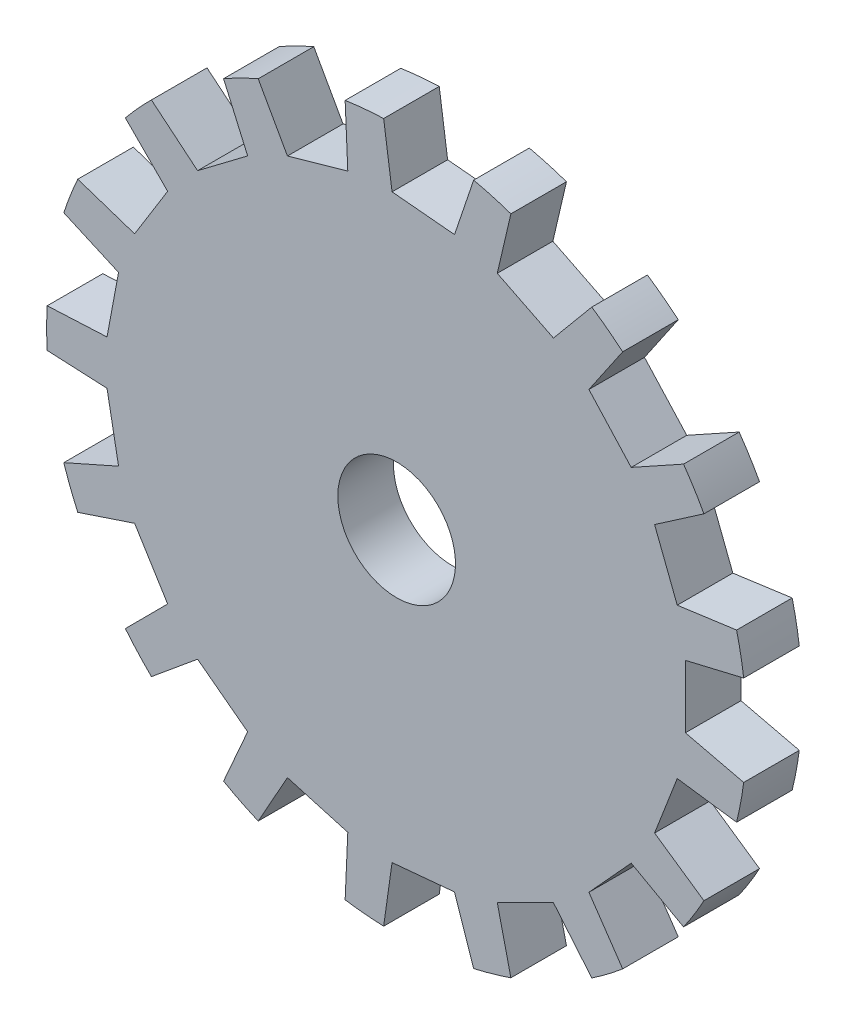
from build123d import *

# Parameters (mm, degrees)
SKETCH1_R               = 28.334624745
BOSS_EXTRUDE1_DEPTH     = 4.5
CUT_EXTRUDE2_DEPTH      = 5.5
CIRPATTERN1_COUNT       = 17
CUT_EXTRUDE4_DEPTH      = 6.5
CUT_EXTRUDE4_DEPTH_BACK = 6.5
SKETCH3_R               = 4.7625


with BuildPart() as part:
    # Sketch1 → Boss-Extrude1 (new body)
    with BuildSketch(Plane.XY):
        Circle(SKETCH1_R)
    extrude(amount=BOSS_EXTRUDE1_DEPTH)

    # Sketch2 → Cut-Extrude2 (cut, symmetric)
    with BuildSketch(Plane.XY):
        Polygon((23.37843536, -2.54), (29.534624745, -4), (29.534624745, 4), (23.37843536, 2.54), align=None)
    cut_extrude2 = extrude(amount=CUT_EXTRUDE2_DEPTH, both=True, mode=Mode.SUBTRACT)

    # CirPattern1: Cut-Extrude2 ×17 about axis
    cirpattern1_axis = Axis((0, 0, -0.225), (0, 0, 1))
    for i in range(1, CIRPATTERN1_COUNT):
        add(cut_extrude2.rotate(cirpattern1_axis, i * 360 / CIRPATTERN1_COUNT), mode=Mode.SUBTRACT)

    # Sketch3 → Cut-Extrude4 (cut, two sides: drawn at the far end of the back side and taken through both)
    with BuildSketch(Plane.XY.offset(-CUT_EXTRUDE4_DEPTH_BACK)):
        Circle(SKETCH3_R)
    extrude(amount=CUT_EXTRUDE4_DEPTH + CUT_EXTRUDE4_DEPTH_BACK, mode=Mode.SUBTRACT)


solid = part.part
